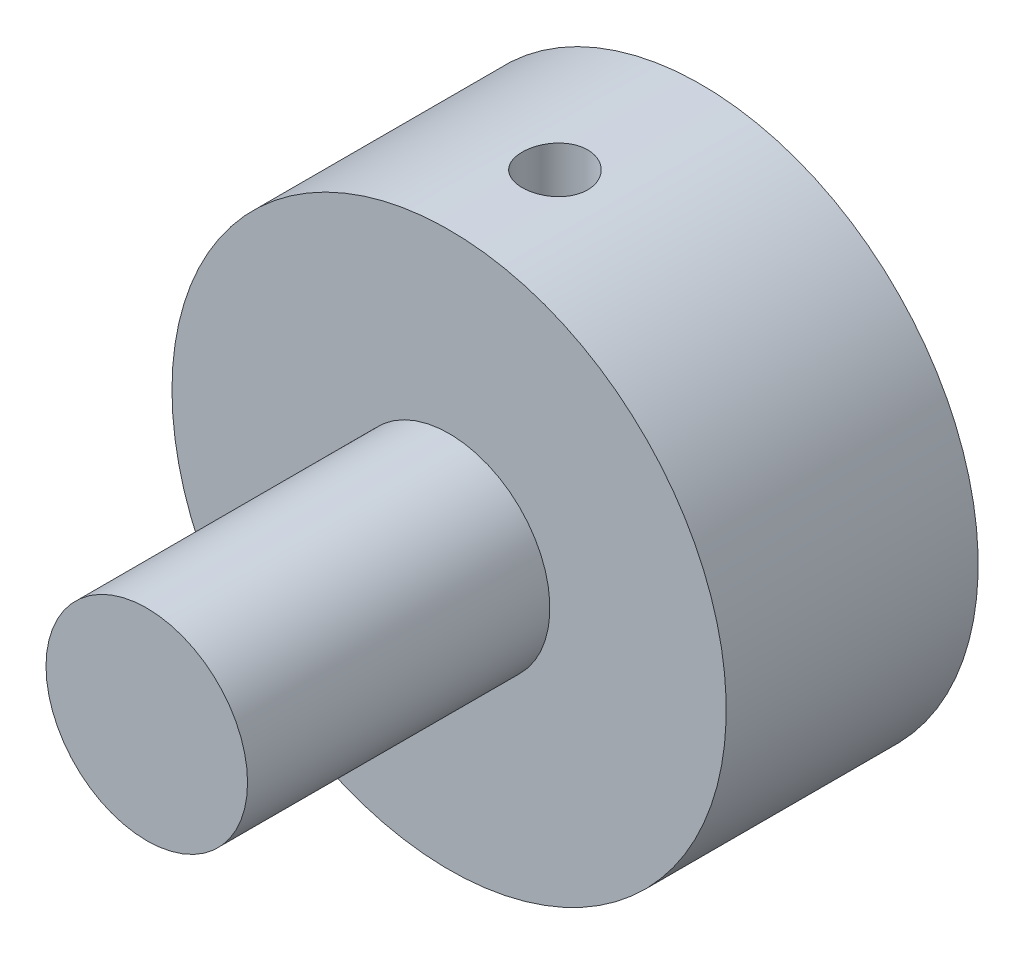
from build123d import *

# Parameters (mm, degrees)
SKETCH1_R               = 4
BOSS_EXTRUDE1_DEPTH     = 12
SKETCH2_R               = 11
BOSS_EXTRUDE2_DEPTH     = 10
CUT_EXTRUDE1_DEPTH      = 20
CUT_EXTRUDE1_DEPTH_BACK = 20
SKETCH3_R               = 1.3


with BuildPart() as part:
    # Sketch1 → Boss-Extrude1 (new body)
    with BuildSketch(Plane.XY):
        Circle(SKETCH1_R)
    extrude(amount=BOSS_EXTRUDE1_DEPTH)

    # Sketch2 → Boss-Extrude2 (add)
    with BuildSketch(Plane(origin=(0, 0, 0), x_dir=(-1, 0, 0), z_dir=(0, 0, -1))):
        Circle(SKETCH2_R)
    extrude(amount=BOSS_EXTRUDE2_DEPTH)

    # Sketch3 → Cut-Extrude1 (cut, two sides: drawn at the far end of the back side and taken through both)
    with BuildSketch(Plane(origin=(0, 0, 0), x_dir=(1, 0, 0), z_dir=(0, 1, 0)).offset(-CUT_EXTRUDE1_DEPTH_BACK)):
        with Locations((0, 4.2)):
            Circle(SKETCH3_R)
    extrude(amount=CUT_EXTRUDE1_DEPTH + CUT_EXTRUDE1_DEPTH_BACK, mode=Mode.SUBTRACT)


solid = part.part
